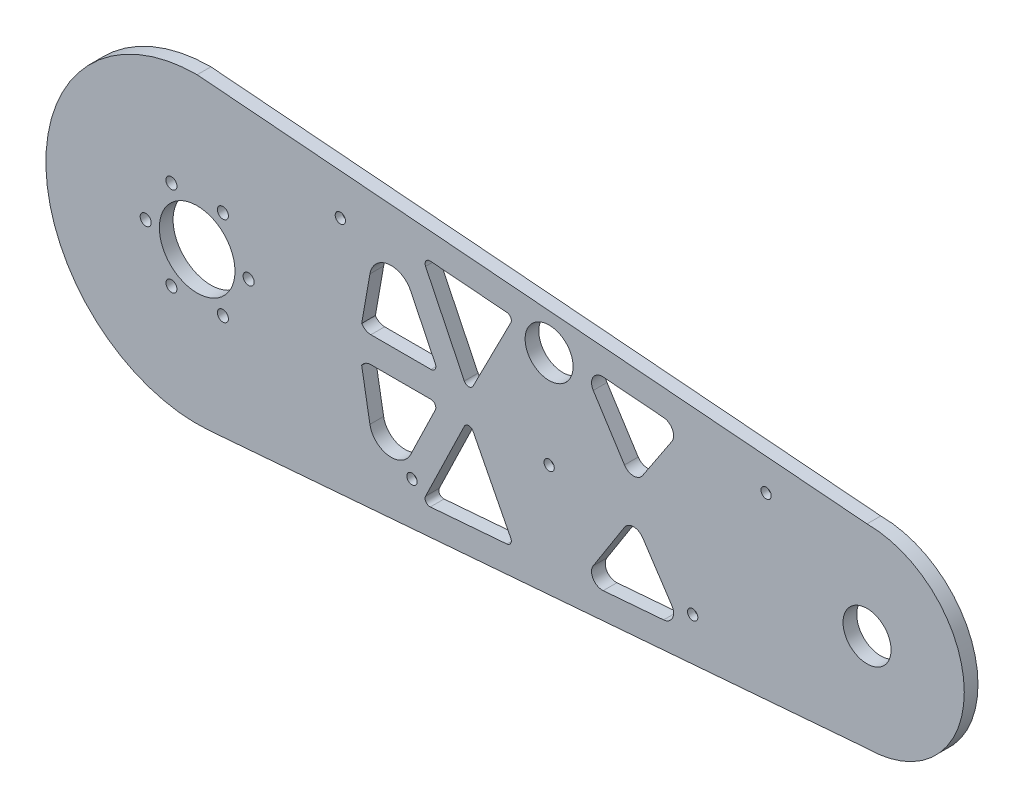
from build123d import *

# Parameters (mm, degrees)
SKETCH1_R              = 14.29385
SKETCH1_R_2            = 11.115
SKETCH1_R_3            = 11.1125
BOSS_EXTRUDE1_DEPTH    = 6.35
CROQUIS1_R             = 2.38125
CORTAR_EXTRUIR1_DEPTH  = 50
CROQUIS6_R             = 2.38125
CORTAR_EXTRUIR6_DEPTH  = 10
CROQUIS8_R             = 17.5
CORTAR_EXTRUIR8_DEPTH  = 10
CROQUIS9_R             = 2.5527
CORTAR_EXTRUIR9_DEPTH  = 10
CROQUIS5_R             = 2.38125
CORTAR_EXTRUIR5_DEPTH  = 10
CROQUIS10_R            = 5
CORTAR_EXTRUIR10_DEPTH = 3.18


with BuildPart() as part:
    # Sketch1 → Boss-Extrude1 (new body)
    with BuildSketch(Plane.XY):
        with BuildLine():
            Line((0, 70), (310, 45))
            ThreePointArc((310, 45), (355, 0), (310, -45))
            Line((310, -45), (5.171398252, -69.808714643))
            ThreePointArc((5.171398252, -69.808714643), (-69.952162315, -2.587467389), (0, 70))
        make_face()
        Circle(SKETCH1_R, mode=Mode.SUBTRACT)
        with Locations((310, 0)):
            Circle(SKETCH1_R_2, mode=Mode.SUBTRACT)
        with Locations((162.878542763, 40)):
            Circle(SKETCH1_R_3, mode=Mode.SUBTRACT)
        with BuildLine():
            Line((107.898974887, 49.259511156), (143.314248041, 46.40344074))
            ThreePointArc((143.314248041, 46.40344074), (145.093535791, 45.259647961), (145.131116366, 43.144768645))
            Line((145.131116366, 43.144768645), (127.657910713, 9.007596386))
            ThreePointArc((127.657910713, 9.007596386), (125.636568061, 7.786360797), (123.64194899, 9.050772613))
            Line((123.64194899, 9.050772613), (105.699881489, 46.044015288))
            ThreePointArc((105.699881489, 46.044015288), (105.866657482, 48.289689684), (107.898974887, 49.259511156))
        make_face(mode=Mode.SUBTRACT)
        with BuildLine():
            Line((80.397390769, 6), (108.202865744, 6))
            ThreePointArc((108.202865744, 6), (110.104277592, 7.052601687), (110.221605239, 9.222756416))
            Line((110.221605239, 9.222756416), (98.78989754, 32.792834786))
            ThreePointArc((98.78989754, 32.792834786), (88.404337676, 38.332134222), (79.941746192, 30.151166228))
            Line((79.941746192, 30.151166228), (76.136119631, 8.384360826))
            ThreePointArc((76.136119631, 8.384360826), (77.955894903, 6.636618521), (80.397390769, 6))
        make_face(mode=Mode.SUBTRACT)
        with BuildLine():
            Line((219.623774494, 32.810522613), (206.130928429, 12.417497436))
            ThreePointArc((206.130928429, 12.417497436), (201.919524559, 10.176643248), (197.745901529, 12.48710226))
            Line((197.745901529, 12.48710226), (183.296864227, 35.133505128))
            ThreePointArc((183.296864227, 35.133505128), (183.227765467, 40.400743015), (187.913912204, 42.80669363))
            Line((187.913912204, 42.80669363), (215.855795571, 40.553315939))
            ThreePointArc((215.855795571, 40.553315939), (219.949772588, 37.757395035), (219.623774494, 32.810522613))
        make_face(mode=Mode.SUBTRACT)
        with BuildLine():
            Line((98.78989754, -32.792834786), (110.221605239, -9.222756416))
            ThreePointArc((110.221605239, -9.222756416), (110.104277592, -7.052601687), (108.202865744, -6))
            Line((108.202865744, -6), (80.397390769, -6))
            ThreePointArc((80.397390769, -6), (77.955894903, -6.636618521), (76.136119631, -8.384360826))
            Line((76.136119631, -8.384360826), (79.941746192, -30.151166228))
            ThreePointArc((79.941746192, -30.151166228), (88.404337676, -38.332134222), (98.78989754, -32.792834786))
        make_face(mode=Mode.SUBTRACT)
        with BuildLine():
            Line((187.913912204, -42.80669363), (215.855795571, -40.553315939))
            ThreePointArc((215.855795571, -40.553315939), (219.949772588, -37.757395035), (219.623774494, -32.810522613))
            Line((219.623774494, -32.810522613), (206.130928429, -12.417497436))
            ThreePointArc((206.130928429, -12.417497436), (201.919524559, -10.176643248), (197.745901529, -12.48710226))
            Line((197.745901529, -12.48710226), (183.296864227, -35.133505128))
            ThreePointArc((183.296864227, -35.133505128), (183.227765467, -40.400743015), (187.913912204, -42.80669363))
        make_face(mode=Mode.SUBTRACT)
        with BuildLine():
            Line((123.64194899, -9.050772613), (105.699881489, -46.044015288))
            ThreePointArc((105.699881489, -46.044015288), (105.866657482, -48.289689684), (107.898974887, -49.259511156))
            Line((107.898974887, -49.259511156), (143.314248041, -46.40344074))
            ThreePointArc((143.314248041, -46.40344074), (145.093535791, -45.259647961), (145.131116366, -43.144768645))
            Line((145.131116366, -43.144768645), (127.657910713, -9.007596386))
            ThreePointArc((127.657910713, -9.007596386), (125.636568061, -7.786360797), (123.64194899, -9.050772613))
        make_face(mode=Mode.SUBTRACT)
    extrude(amount=BOSS_EXTRUDE1_DEPTH)

    # Croquis1 → Cortar-Extruir1 (cut)
    with BuildSketch(Plane.XY.offset(6.35)):
        with Locations((99.417366651, -42.272966779)):
            Circle(CROQUIS1_R)
        with Locations((229.299162877, -31.702435007)):
            Circle(CROQUIS1_R)
    extrude(amount=-CORTAR_EXTRUIR1_DEPTH, mode=Mode.SUBTRACT)

    # Croquis6 → Cortar-Extruir6 (cut)
    with BuildSketch(Plane.XY.offset(6.35)):
        with Locations((66.263169386, 45.68611009)):
            Circle(CROQUIS6_R)
        with Locations((263.293381054, 34.027262471)):
            Circle(CROQUIS6_R)
    extrude(amount=-CORTAR_EXTRUIR6_DEPTH, mode=Mode.SUBTRACT)

    # Croquis8 → Cortar-Extruir8 (cut)
    with BuildSketch(Plane.XY.offset(6.35)):
        Circle(CROQUIS8_R)
    extrude(amount=-CORTAR_EXTRUIR8_DEPTH, mode=Mode.SUBTRACT)

    # Croquis9 → Cortar-Extruir9 (cut)
    with BuildSketch(Plane(origin=(0, 0, 0), x_dir=(-1, 0, 0), z_dir=(0, 0, -1))):
        with Locations((23.8125, 0)):
            Circle(CROQUIS9_R)
        with Locations((11.90625, -20.622229928)):
            Circle(CROQUIS9_R)
        with Locations((-11.90625, -20.622229928)):
            Circle(CROQUIS9_R)
        with Locations((-23.8125, 0)):
            Circle(CROQUIS9_R)
        with Locations((-11.90625, 20.622229928)):
            Circle(CROQUIS9_R)
        with Locations((11.90625, 20.622229928)):
            Circle(CROQUIS9_R)
    extrude(amount=-CORTAR_EXTRUIR9_DEPTH, mode=Mode.SUBTRACT)

    # Croquis5 → Cortar-Extruir5 (cut)
    with BuildSketch(Plane.XY.offset(6.35)):
        with Locations((162.878542763, -5)):
            Circle(CROQUIS5_R)
    extrude(amount=-CORTAR_EXTRUIR5_DEPTH, mode=Mode.SUBTRACT)

    # Croquis10 → Cortar-Extruir10 (cut)
    with BuildSketch(Plane(origin=(0, 0, 0), x_dir=(-1, 0, 0), z_dir=(0, 0, -1))):
        with Locations((-263.293381054, 34.027262471)):
            Circle(CROQUIS10_R)
        with Locations((-66.263169386, 45.68611009)):
            Circle(CROQUIS10_R)
        with Locations((-229.299162877, -31.702435007)):
            Circle(CROQUIS10_R)
        with Locations((-99.417366651, -42.272966779)):
            Circle(CROQUIS10_R)
        with Locations((-162.878542763, -5)):
            Circle(CROQUIS10_R)
    extrude(amount=-CORTAR_EXTRUIR10_DEPTH, mode=Mode.SUBTRACT)


solid = part.part
